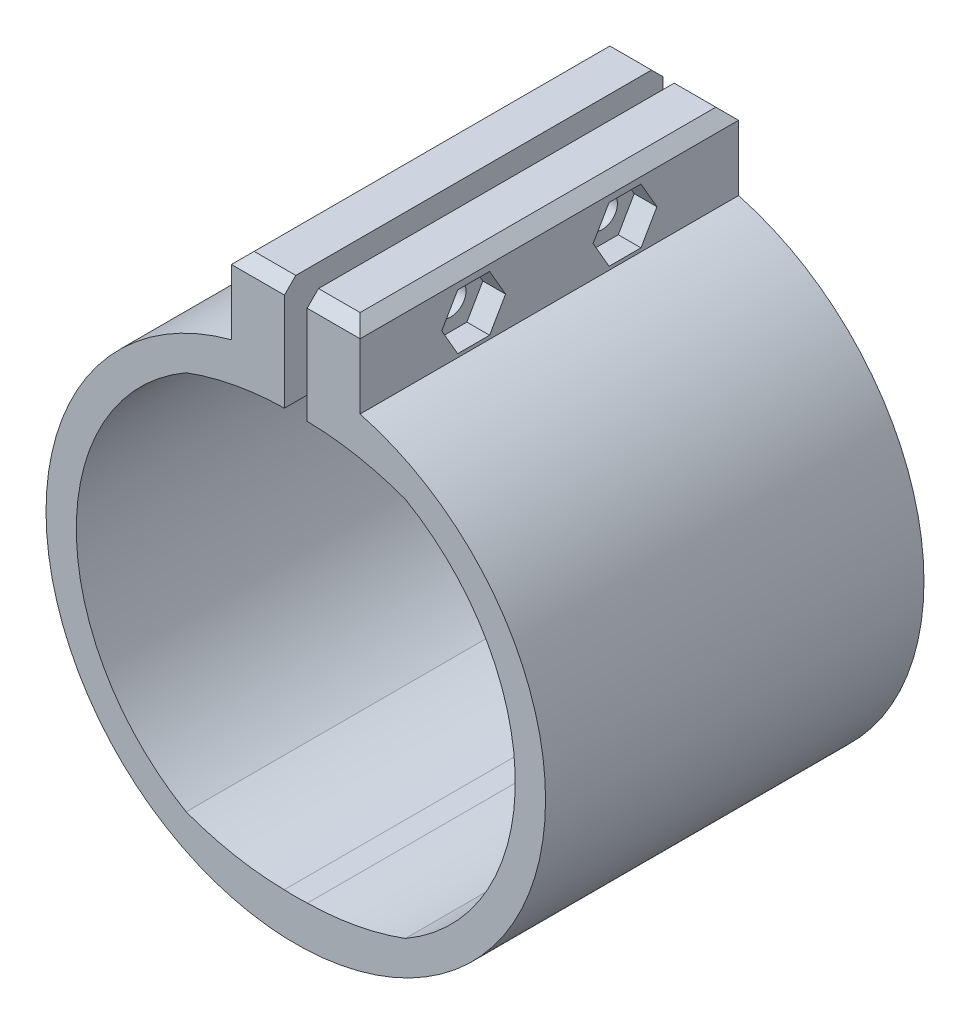
from build123d import *

# Parameters (mm, degrees)
EXTRUDE_1_DEPTH          = 50
CUT_EXTRUDE_1_DEPTH      = 74.164198895
CUT_EXTRUDE_1_DEPTH_BACK = 74.164198895
SKETCH_2_R               = 2
SKETCH_3_R               = 3.5
CUT_EXTRUDE_2_DEPTH      = 2
CHAMFER_1_SIZE           = 1.5
CUT_EXTRUDE_3_DEPTH      = 3


with BuildPart() as part:
    # 스케치1 → 보스-돌출1 (new body)
    with BuildSketch(Plane.XY):
        with BuildLine():
            Line((-1.5, 32.465366161), (-1.5, 42))
            Line((-1.5, 42), (-8.5, 42))
            Line((-8.5, 42), (-8.5, 31.886517527))
            ThreePointArc((-8.5, 31.886517527), (0, -33), (8.5, 31.886517527))
            Line((8.5, 31.886517527), (8.5, 42))
            Line((8.5, 42), (1.5, 42))
            Line((1.5, 42), (1.5, 32.465366161))
            Line((1.5, 32.465366161), (1.5, 27.559208987))
            ThreePointArc((1.5, 27.559208987), (1.514407087, 27.558421057), (1.528813761, 27.557625596))
            ThreePointArc((1.528813761, 27.557625596), (8.110662779, 26.890433295), (14.48576204, 25.122951621))
            ThreePointArc((14.48576204, 25.122951621), (29, 0), (14.48576204, -25.122951621))
            ThreePointArc((14.48576204, -25.122951621), (8.110662779, -26.890433295), (1.528813761, -27.557625596))
            ThreePointArc((1.528813761, -27.557625596), (0, -27.6), (-1.528813761, -27.557625596))
            ThreePointArc((-1.528813761, -27.557625596), (-8.110662779, -26.890433295), (-14.48576204, -25.122951621))
            ThreePointArc((-14.48576204, -25.122951621), (-29, 0), (-14.48576204, 25.122951621))
            ThreePointArc((-14.48576204, 25.122951621), (-8.110662779, 26.890433295), (-1.528813761, 27.557625596))
            ThreePointArc((-1.528813761, 27.557625596), (-1.514407087, 27.558421057), (-1.5, 27.559208987))
            Line((-1.5, 27.559208987), (-1.5, 32.465366161))
        make_face()
    extrude(amount=EXTRUDE_1_DEPTH)

    # 스케치2 → 컷-돌출1 (cut, two sides: drawn at the far end of the back side and taken through both)
    with BuildSketch(Plane(origin=(0, 0, 0), x_dir=(0, 0, -1), z_dir=(1, 0, 0)).offset(-CUT_EXTRUDE_1_DEPTH_BACK)):
        with Locations(Location((-35, 36, 0), (0, 0, 90))):
            Circle(SKETCH_2_R)
        with Locations(Location((-15, 36, 0), (0, 0, 90))):
            Circle(SKETCH_2_R)
    extrude(amount=CUT_EXTRUDE_1_DEPTH + CUT_EXTRUDE_1_DEPTH_BACK, mode=Mode.SUBTRACT)

    # 스케치3 → 컷-돌출2 (cut)
    with BuildSketch(Plane.ZY.offset(8.5)):
        with Locations((15, 36)):
            Circle(SKETCH_3_R)
        with Locations((35, 36)):
            Circle(SKETCH_3_R)
    extrude(amount=-CUT_EXTRUDE_2_DEPTH, mode=Mode.SUBTRACT)

    # 모따기1
    chamfer_1_edges = [part.edges().sort_by_distance(p)[0] for p in [
        (-5, 42, 50),
        (5, 42, 0),
        (-5, 42, 0),
        (5, 42, 50),
        (8.5, 42, 25),
        (-8.5, 42, 25),
    ]]
    chamfer(chamfer_1_edges, length=CHAMFER_1_SIZE)

    # 스케치4 → 컷-돌출3 (cut)
    with BuildSketch(Plane(origin=(8.5, 0, 0), x_dir=(0, 0, -1), z_dir=(1, 0, 0))):
        Polygon((-30.785343035, 36), (-32.892671517, 39.65), (-37.107328483, 39.65), (-39.214656965, 36), (-37.107328483, 32.35), (-32.892671517, 32.35), align=None)
        Polygon((-10.785343035, 36), (-12.892671517, 39.65), (-17.107328483, 39.65), (-19.214656965, 36), (-17.107328483, 32.35), (-12.892671517, 32.35), align=None)
    extrude(amount=-CUT_EXTRUDE_3_DEPTH, mode=Mode.SUBTRACT)


solid = part.part
